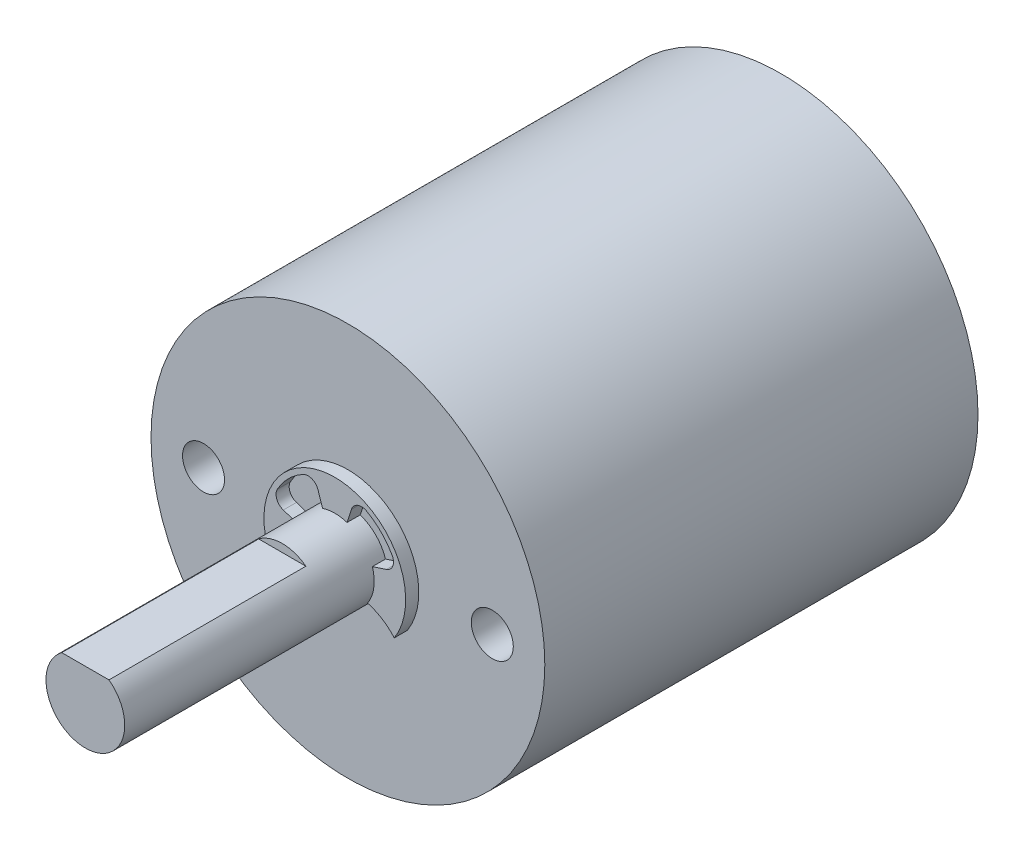
from build123d import *

# Parameters (mm, degrees)
SKETCH_1_R             = 7.5
EXTRUDE_1_DEPTH        = 16.5
SKETCH_2_R             = 1.5
EXTRUDE_2_DEPTH        = 10
SKETCH_3_W             = 3.798806197
SKETCH_3_H             = 0.511244187
CUT_EXTRUDE_1_DEPTH    = 7.5
HOLE_WIZARD_M2_1_D     = 1.6
HOLE_WIZARD_M2_1_DEPTH = 6
HOLE_WIZARD_M2_1_TIP   = 0.461880215
EXTRUDE_3_DEPTH        = 0.5


with BuildPart() as part:
    # 草图1 → 凸台-拉伸1 (new body)
    with BuildSketch(Plane.XY):
        Circle(SKETCH_1_R)
    extrude(amount=EXTRUDE_1_DEPTH)

    # 草图2 → 凸台-拉伸2 (add)
    with BuildSketch(Plane.XY.offset(16.5)):
        Circle(SKETCH_2_R)
    extrude(amount=EXTRUDE_2_DEPTH)

    # 草图3 → 切除-拉伸1 (cut)
    with BuildSketch(Plane.XY.offset(26.5)):
        with Locations((0.268189439, 1.455622094)):
            Rectangle(SKETCH_3_W, SKETCH_3_H)
    extrude(amount=-CUT_EXTRUDE_1_DEPTH, mode=Mode.SUBTRACT)

    # M2 螺纹孔1
    with Locations(Plane(origin=(5.5, 0, 16.5), x_dir=(1, 0, 0), z_dir=(0, 0, 1))):
        with Locations((0, 0), (-11, 0)):
            Hole(HOLE_WIZARD_M2_1_D / 2, depth=HOLE_WIZARD_M2_1_DEPTH)
            with Locations((0, 0, -(HOLE_WIZARD_M2_1_DEPTH + HOLE_WIZARD_M2_1_TIP / 2))):  # 120° drill point
                Cone(0, HOLE_WIZARD_M2_1_D / 2, HOLE_WIZARD_M2_1_TIP, mode=Mode.SUBTRACT)

    # 草图7 → 凸台-拉伸3 (add)
    with BuildSketch(Plane.XY.offset(16.5)):
        with BuildLine():
            Line((1.960938779, 0.623596473), (1.426870317, 0.45006711))
            ThreePointArc((1.426870317, 0.45006711), (1.48648304, -0.216478082), (1.250285543, -0.842614579))
            add(Edge.make_bspline(
                [(1.250285543, -0.842614579), (1.850110882, -1.011418293), (2.265901859, -1.482125365)],
                knots=[0, 0, 0, 1, 1, 1], degree=2))
            ThreePointArc((2.265901859, -1.482125365), (0.000285543, 2.686541619), (-2.265330773, -1.482125365))
            add(Edge.make_bspline(
                [(-2.265330773, -1.482125365), (-1.9353519, -0.830261296), (-1.249714457, -0.842614579)],
                knots=[0, 0, 0, 1, 1, 1], degree=2))
            ThreePointArc((-1.249714457, -0.842614579), (-1.485911955, -0.216478082), (-1.426299232, 0.45006711))
            Line((-1.426299232, 0.45006711), (-1.960367694, 0.623596473))
            ThreePointArc((-1.960367694, 0.623596473), (-2.208903067, 0.857355504), (-2.186674503, 1.19782431))
            ThreePointArc((-2.186674503, 1.19782431), (-1.76748141, 1.754308572), (-1.210997148, 2.173501665))
            ThreePointArc((-1.210997148, 2.173501665), (-0.870528343, 2.195730229), (-0.636769311, 1.947194855))
            Line((-0.636769311, 1.947194855), (-0.463239949, 1.413126393))
            ThreePointArc((-0.463239949, 1.413126393), (0.000285543, 1.486541619), (0.463811034, 1.413126393))
            Line((0.463811034, 1.413126393), (0.637340397, 1.947194855))
            ThreePointArc((0.637340397, 1.947194855), (0.871099428, 2.195730229), (1.211568234, 2.173501665))
            ThreePointArc((1.211568234, 2.173501665), (1.768052496, 1.754308572), (2.187245589, 1.19782431))
            ThreePointArc((2.187245589, 1.19782431), (2.209474153, 0.857355504), (1.960938779, 0.623596473))
        make_face()
    extrude(amount=EXTRUDE_3_DEPTH)


solid = part.part
